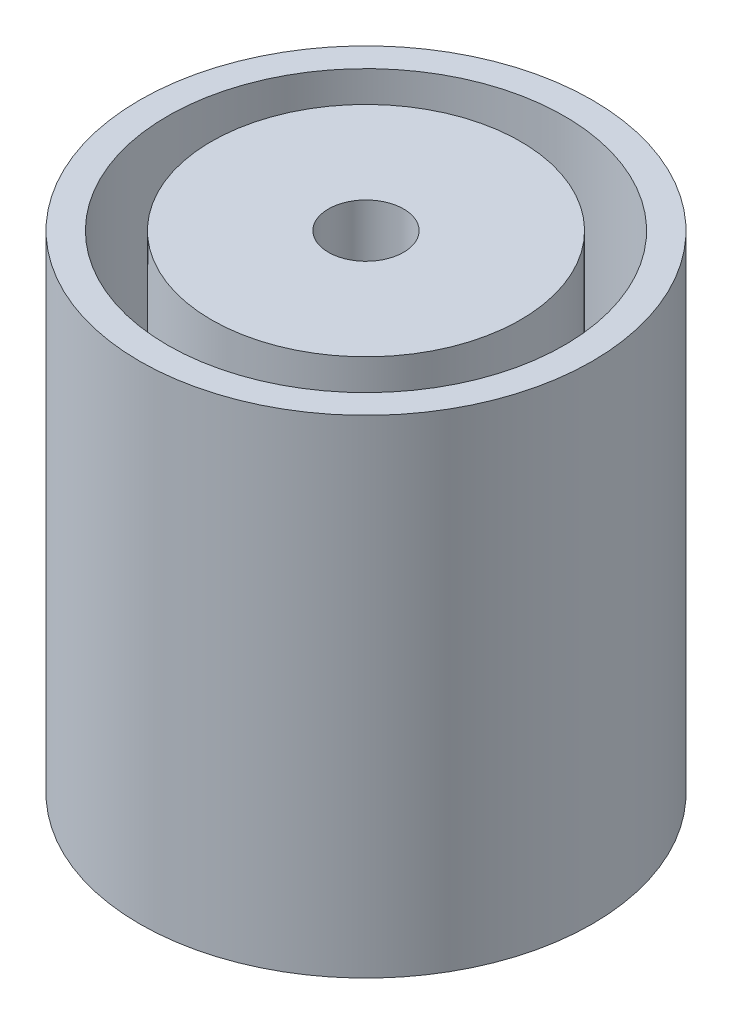
from build123d import *

# Parameters (mm, degrees)
SKETCH1_R           = 16.25
BOSS_EXTRUDE1_DEPTH = 15
SKETCH2_R           = 11.1
BOSS_EXTRUDE2_DEPTH = 20
SKETCH3_R           = 16.25
SKETCH3_R_2         = 14.25
BOSS_EXTRUDE4_DEPTH = 20
SKETCH4_R           = 2.7
CUT_EXTRUDE1_DEPTH  = 30


with BuildPart() as part:
    # Sketch1 → Boss-Extrude1 (new body)
    with BuildSketch(Plane(origin=(0, 0, 0), x_dir=(1, 0, 0), z_dir=(0, 1, 0))):
        with Locations(Location((0, 0, 0), (0, 0, 270))):
            Circle(SKETCH1_R)
    extrude(amount=BOSS_EXTRUDE1_DEPTH)

    # Sketch2 → Boss-Extrude2 (add)
    with BuildSketch(Plane(origin=(0, 15, 0), x_dir=(1, 0, 0), z_dir=(0, 1, 0))):
        with Locations(Location((0, 0, 0), (0, 0, 270))):
            Circle(SKETCH2_R)
    extrude(amount=BOSS_EXTRUDE2_DEPTH)

    # Sketch3 → Boss-Extrude4 (add)
    with BuildSketch(Plane(origin=(0, 15, 0), x_dir=(1, 0, 0), z_dir=(0, 1, 0))):
        with Locations(Location((0, 0, 0), (0, 0, 270))):
            Circle(SKETCH3_R)
        with Locations(Location((0, 0, 0), (0, 0, 270))):
            Circle(SKETCH3_R_2, mode=Mode.SUBTRACT)
    extrude(amount=BOSS_EXTRUDE4_DEPTH)

    # Sketch4 → Cut-Extrude1 (cut)
    with BuildSketch(Plane(origin=(0, 35, 0), x_dir=(1, 0, 0), z_dir=(0, 1, 0))):
        with Locations(Location((0, 0, 0), (0, 0, 270))):
            Circle(SKETCH4_R)
    extrude(amount=-CUT_EXTRUDE1_DEPTH, mode=Mode.SUBTRACT)


solid = part.part
